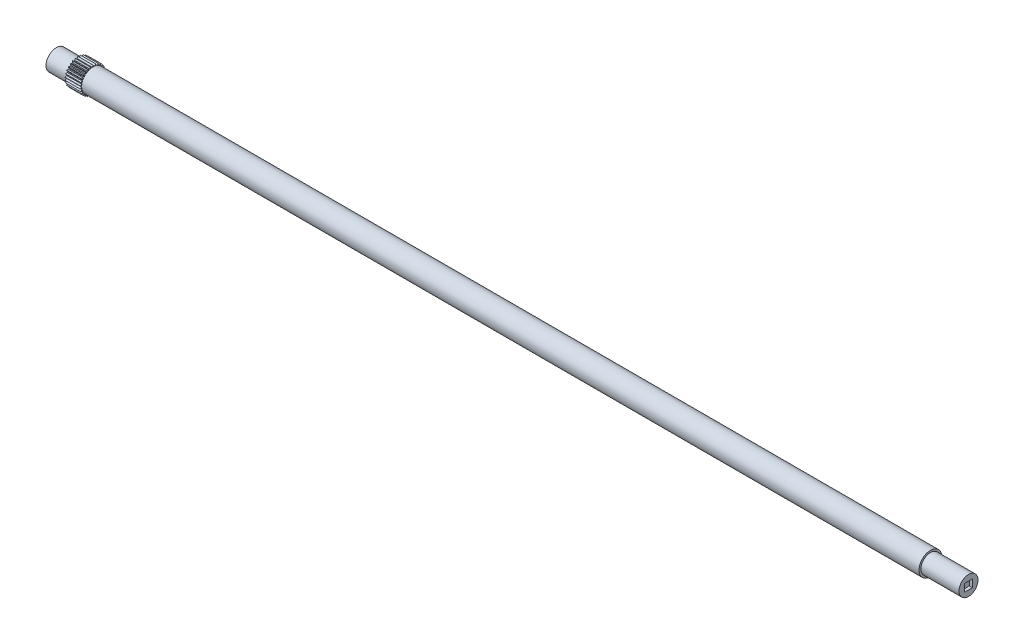
from build123d import *

# Parameters (mm, degrees)
BOSS_EXTRUDE1_DEPTH = 12.7
CIRPATTERN1_COUNT   = 30
SKETCH3_R           = 8.618103117
BOSS_EXTRUDE2_DEPTH = 17.4625
SKETCH4_W           = 6.35
SKETCH4_H           = 6.35
MAGIC_BOX_DEPTH     = 2.54


with BuildPart() as part:
    # Sketch1 → Revolve1 (revolve)
    with BuildSketch(Plane.XY):
        Polygon((-371.475, 0), (371.475, 0), (371.475, 7.9375), (339.725, 7.9375), (339.725, 9.525), (-371.475, 9.525), align=None)
    revolve(axis=Axis((-389.812509547, 0, 0), (1, 0, 0)))

    # Sketch2 → Boss-Extrude1 (add)
    with BuildSketch(Plane.ZY.offset(371.475)):
        with BuildLine():
            Line((0, 10.795), (-0.678872241, 9.500776678))
            ThreePointArc((-0.678872241, 9.500776678), (0, 9.525), (0.678872241, 9.500776678))
            Line((0.678872241, 9.500776678), (0, 10.795))
        make_face()
    boss_extrude1 = extrude(amount=-BOSS_EXTRUDE1_DEPTH)

    # CirPattern1: Boss-Extrude1 ×30 about axis
    cirpattern1_axis = Axis((-371.475, 0, 0), (-1, 0, 0))
    for i in range(1, CIRPATTERN1_COUNT):
        add(boss_extrude1.rotate(cirpattern1_axis, i * 360 / CIRPATTERN1_COUNT))

    # Sketch3 → Boss-Extrude2 (add)
    with BuildSketch(Plane.ZY.offset(371.475)):
        with Locations((0.494197933, 0)):
            Circle(SKETCH3_R)
    extrude(amount=BOSS_EXTRUDE2_DEPTH)

    # Sketch4 → Magic Box (cut)
    with BuildSketch(Plane(origin=(371.475, 0, 0), x_dir=(0, 0, -1), z_dir=(1, 0, 0))):
        Rectangle(SKETCH4_W, SKETCH4_H)
    extrude(amount=-MAGIC_BOX_DEPTH, mode=Mode.SUBTRACT)


solid = part.part
